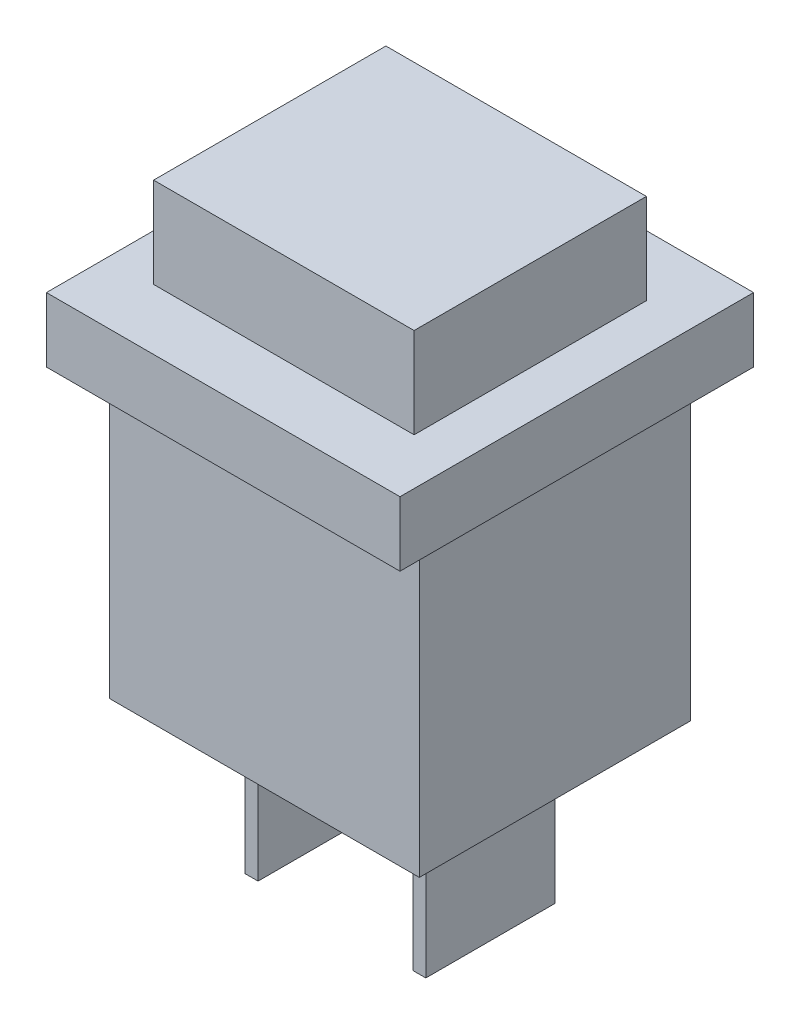
from build123d import *

# Parameters (mm, degrees)
SKETCH_1_W      = 12
SKETCH_1_H      = 10.5
EXTRUDE_1_DEPTH = 11.5
SKETCH_2_W      = 13.7
SKETCH_2_H      = 13.7
EXTRUDE_2_DEPTH = 2.5
SKETCH_3_W      = 10.093154374
SKETCH_3_H      = 9
EXTRUDE_3_DEPTH = 3.5
SKETCH_4_W      = 0.5
SKETCH_4_H      = 5
EXTRUDE_4_DEPTH = 6


with BuildPart() as part:
    # Эскиз1 → Бобышка-Вытянуть1 (new body)
    with BuildSketch(Plane(origin=(0, 0, 0), x_dir=(1, 0, 0), z_dir=(0, 1, 0))):
        with Locations((6, 5.25)):
            Rectangle(SKETCH_1_W, SKETCH_1_H)
    extrude(amount=EXTRUDE_1_DEPTH)

    # Эскиз2 → Бобышка-Вытянуть2 (add)
    with BuildSketch(Plane(origin=(0, 11.5, 0), x_dir=(1, 0, 0), z_dir=(0, 1, 0))):
        with Locations((6, 5.25)):
            Rectangle(SKETCH_2_W, SKETCH_2_H)
    extrude(amount=EXTRUDE_2_DEPTH)

    # Эскиз4 → Бобышка-Вытянуть4 (add)
    with BuildSketch(Plane(origin=(0, 0, 0), x_dir=(-1, 0, 0), z_dir=(0, -1, 0))):
        with Locations((-2.75, 5.25)):
            Rectangle(SKETCH_4_W, SKETCH_4_H)
        with Locations((-9.25, 5.25)):
            Rectangle(SKETCH_4_W, SKETCH_4_H)
    extrude(amount=EXTRUDE_4_DEPTH)


with BuildPart() as body_2:
    # Эскиз3 → Бобышка-Вытянуть3 (new body)
    with BuildSketch(Plane(origin=(0, 14, 0), x_dir=(1, 0, 0), z_dir=(0, 1, 0))):
        with Locations((6, 5.25)):
            Rectangle(SKETCH_3_W, SKETCH_3_H)
    extrude(amount=EXTRUDE_3_DEPTH)


solid = Compound([part.part, body_2.part])
